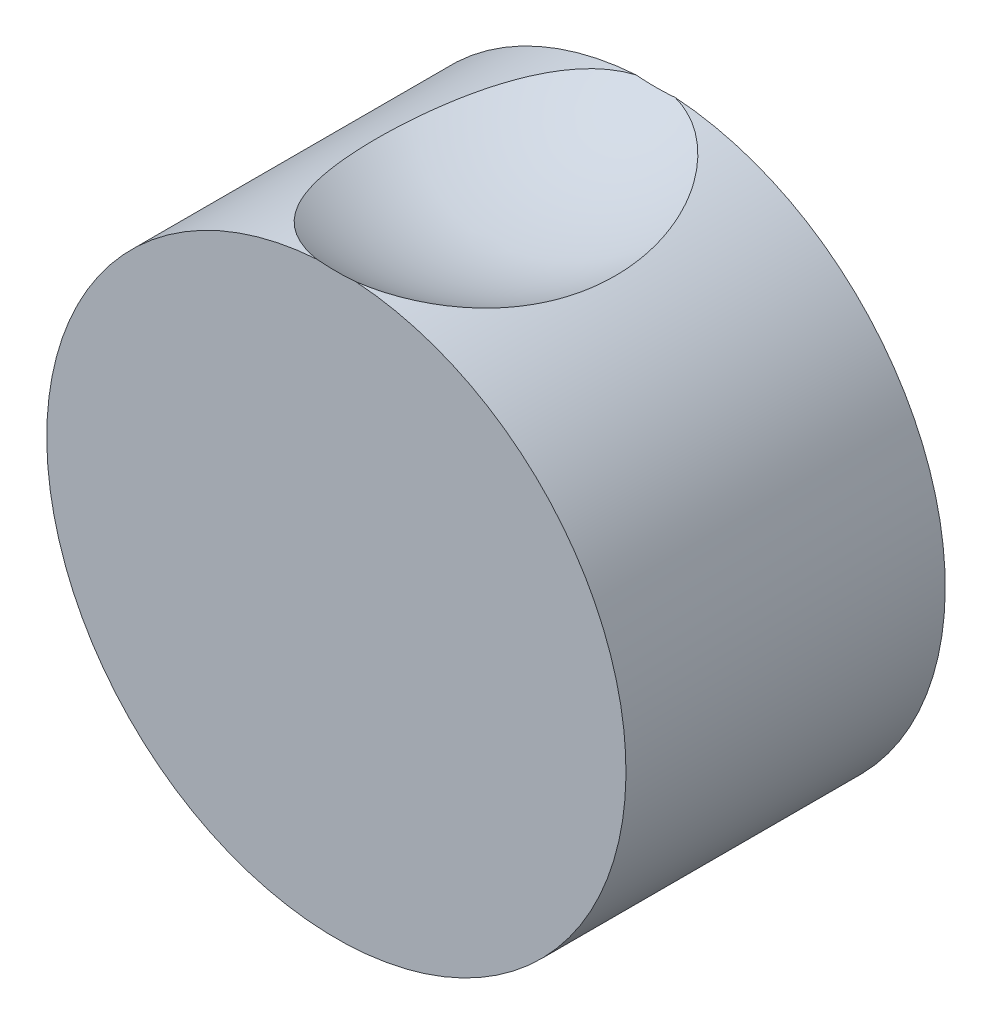
from build123d import *

# Parameters (mm, degrees)
SKETCH1_R           = 12.7
BOSS_EXTRUDE1_DEPTH = 7


with BuildPart() as part:
    # Sketch1 → Boss-Extrude1 (new, symmetric)
    with BuildSketch(Plane.XY):
        Circle(SKETCH1_R)
    extrude(amount=BOSS_EXTRUDE1_DEPTH, both=True)

    # Sketch3 → Cut-Revolve1 (revolve, cut)
    with BuildSketch(Plane(origin=(0, 0, 0), x_dir=(0, 0, -1), z_dir=(1, 0, 0))):
        with BuildLine():
            Line((0, 34.380510343), (0, 10.380510343))
            ThreePointArc((0, 10.380510343), (12, 22.380510343), (0, 34.380510343))
        make_face()
    revolve(axis=Axis((0, 34.380510343, 0), (0, -1, 0)), mode=Mode.SUBTRACT)


solid = part.part
